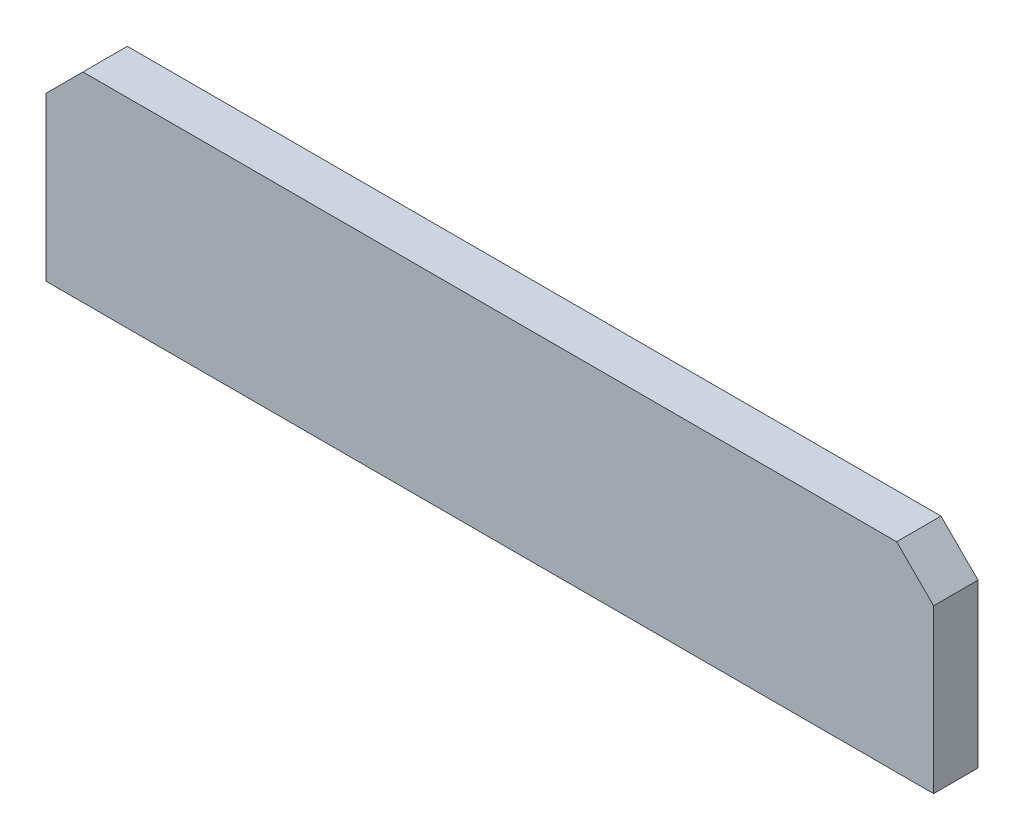
from build123d import *

# Parameters (mm, degrees)
SKETCH_1_W      = 120
SKETCH_1_H      = 27
EXTRUDE_1_DEPTH = 6
CHAMFER_1_SIZE  = 5


with BuildPart() as part:
    # 草图1 → 凸台-拉伸1 (new body)
    with BuildSketch(Plane.XY):
        Rectangle(SKETCH_1_W, SKETCH_1_H)
    extrude(amount=EXTRUDE_1_DEPTH)

    # 倒角1
    chamfer_1_edges = [part.edges().sort_by_distance(p)[0] for p in [
        (-60, 13.5, 3),
        (60, 13.5, 3),
    ]]
    chamfer(chamfer_1_edges, length=CHAMFER_1_SIZE)


solid = part.part
